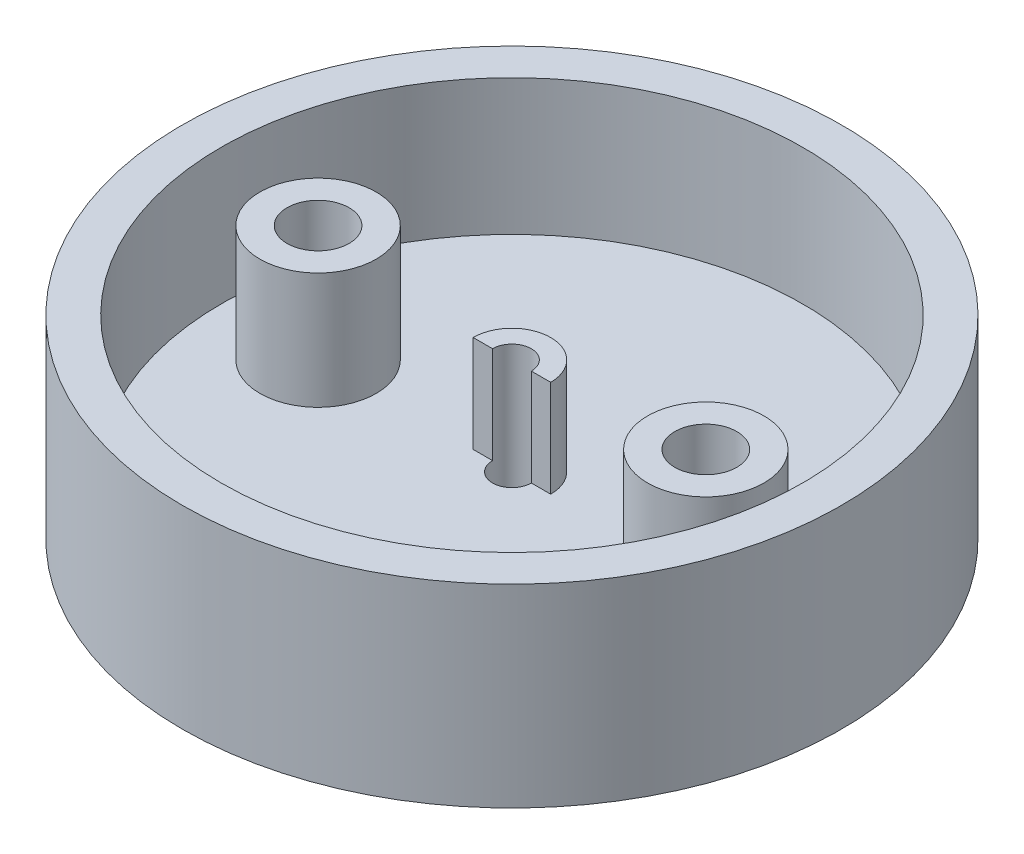
from build123d import *

# Parameters (mm, degrees)
CROQUIS1_R              = 17
CROQUIS1_R_2            = 1
CROQUIS1_R_3            = 1.6
SALIENTE_EXTRUIR1_DEPTH = 3
CROQUIS2_R              = 17
CROQUIS2_R_2            = 15
SALIENTE_EXTRUIR2_DEPTH = 7
CROQUIS3_R              = 3
CROQUIS3_R_2            = 1.6
SALIENTE_EXTRUIR3_DEPTH = 6
SALIENTE_EXTRUIR4_DEPTH = 5


with BuildPart() as part:
    # Croquis1 → Saliente-Extruir1 (new body)
    with BuildSketch(Plane(origin=(0, 0, 0), x_dir=(1, 0, 0), z_dir=(0, 1, 0))):
        with Locations(Location((0, 0, 0), (0, 0, 270))):
            Circle(CROQUIS1_R)
        with Locations(Location((0, 0, 0), (0, 0, 270))):
            Circle(CROQUIS1_R_2, mode=Mode.SUBTRACT)
        with Locations(Location((-10, 0, 0), (0, 0, 270))):
            Circle(CROQUIS1_R_3, mode=Mode.SUBTRACT)
        with Locations(Location((10, 0, 0), (0, 0, 270))):
            Circle(CROQUIS1_R_3, mode=Mode.SUBTRACT)
    extrude(amount=SALIENTE_EXTRUIR1_DEPTH)

    # Croquis2 → Saliente-Extruir2 (add)
    with BuildSketch(Plane(origin=(0, 3, 0), x_dir=(1, 0, 0), z_dir=(0, 1, 0))):
        with Locations(Location((0, 0, 0), (0, 0, 270))):
            Circle(CROQUIS2_R)
        with Locations(Location((0, 0, 0), (0, 0, 270))):
            Circle(CROQUIS2_R_2, mode=Mode.SUBTRACT)
    extrude(amount=SALIENTE_EXTRUIR2_DEPTH)

    # Croquis3 → Saliente-Extruir3 (add)
    # profile 1 of 2: a face of its own
    with BuildSketch(Plane(origin=(0, 3, 0), x_dir=(1, 0, 0), z_dir=(0, 1, 0))):
        with Locations(Location((10, 0, 0), (0, 0, 270))):
            Circle(CROQUIS3_R)
        with Locations(Location((10, 0, 0), (0, 0, 270))):
            Circle(CROQUIS3_R_2, mode=Mode.SUBTRACT)
    # profile 2 of 2: a face of its own
    with BuildSketch(Plane(origin=(0, 3, 0), x_dir=(1, 0, 0), z_dir=(0, 1, 0))):
        with Locations(Location((-10, 0, 0), (0, 0, 270))):
            Circle(CROQUIS3_R)
        with Locations(Location((-10, 0, 0), (0, 0, 270))):
            Circle(CROQUIS3_R_2, mode=Mode.SUBTRACT)
    extrude(amount=SALIENTE_EXTRUIR3_DEPTH)

    # Croquis4 → Saliente-Extruir4 (add)
    with BuildSketch(Plane(origin=(0, 3, 0), x_dir=(1, 0, 0), z_dir=(0, 1, 0))):
        with BuildLine():
            Line((1, 0), (2, 0))
            ThreePointArc((2, 0), (0, 2), (-2, 0))
            Line((-2, 0), (-1, 0))
            ThreePointArc((-1, 0), (0, 1), (1, 0))
        make_face()
    extrude(amount=SALIENTE_EXTRUIR4_DEPTH)


solid = part.part
